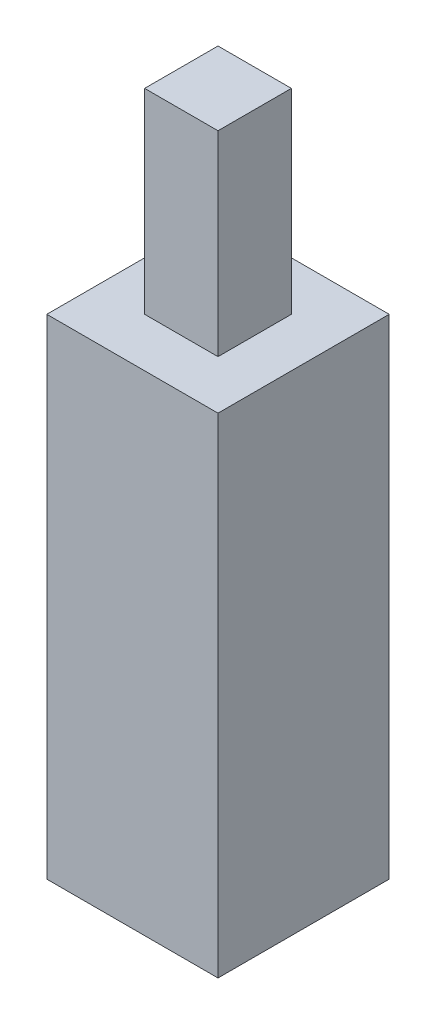
from build123d import *

# Parameters (mm, degrees)
SKETCH1_W           = 7
SKETCH1_H           = 7
BOSS_EXTRUDE1_DEPTH = 20
SKETCH2_W           = 3
SKETCH2_H           = 3
BOSS_EXTRUDE2_DEPTH = 8


with BuildPart() as part:
    # Sketch1 → Boss-Extrude1 (new body)
    with BuildSketch(Plane(origin=(0, 0, 0), x_dir=(1, 0, 0), z_dir=(0, 1, 0))):
        with Locations((3.5, 3.5)):
            Rectangle(SKETCH1_W, SKETCH1_H)
    extrude(amount=BOSS_EXTRUDE1_DEPTH)

    # Sketch2 → Boss-Extrude2 (add)
    with BuildSketch(Plane(origin=(0, 20, 0), x_dir=(1, 0, 0), z_dir=(0, 1, 0))):
        with Locations((3.5, 3.5)):
            Rectangle(SKETCH2_W, SKETCH2_H)
    extrude(amount=BOSS_EXTRUDE2_DEPTH)


solid = part.part
